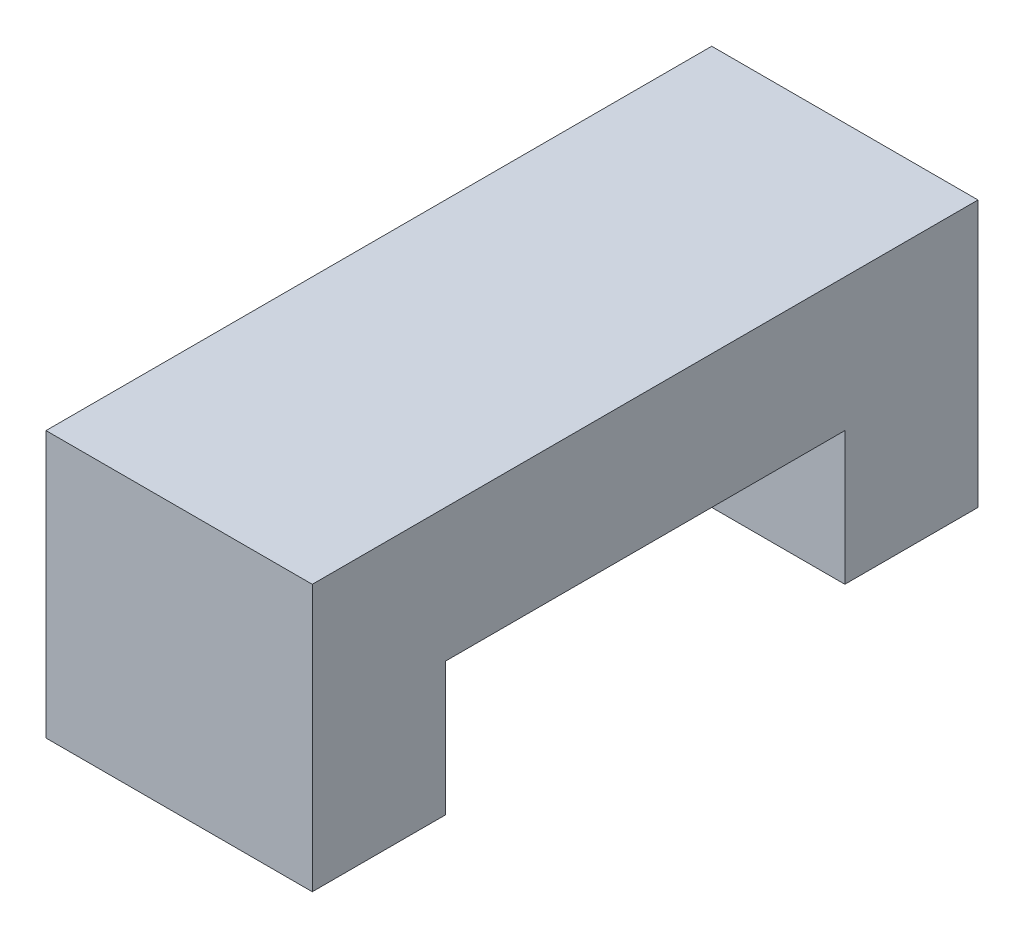
from build123d import *

# Parameters (mm, degrees)
EXTRUDE_1_DEPTH = 10


with BuildPart() as part:
    # 草图1 → 凸台-拉伸1 (new body)
    with BuildSketch(Plane(origin=(0, 0, 0), x_dir=(0, 0, -1), z_dir=(1, 0, 0))):
        Polygon((0, 0), (-5, 0), (-5, 10), (20, 10), (20, 0), (15, 0), (15, 5), (0, 5), align=None)
    extrude(amount=EXTRUDE_1_DEPTH)


solid = part.part
